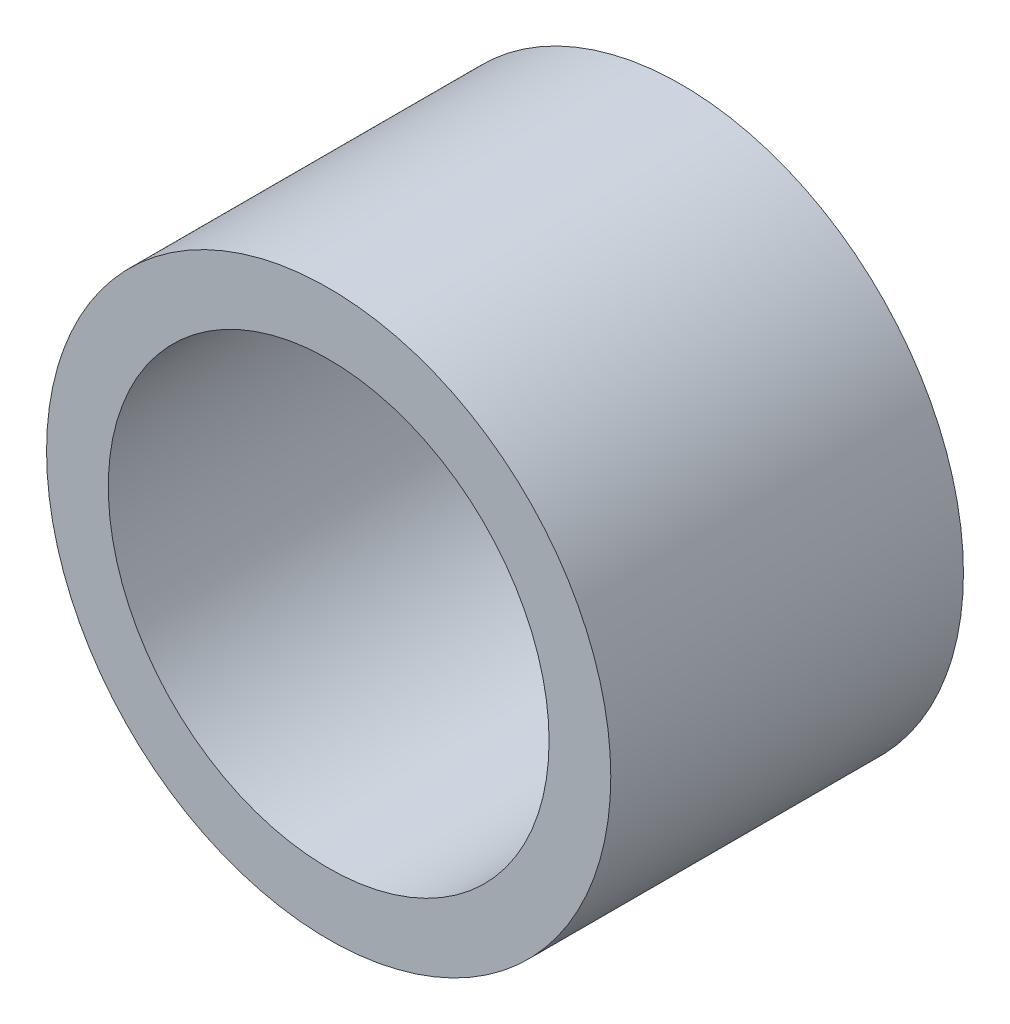
from build123d import *

# Parameters (mm, degrees)
ESBO_O1_R                = 16
RESSALTO_EXTRUS_O1_DEPTH = 20
ESBO_O2_R                = 12.5
CORTE_EXTRUS_O1_DEPTH    = 20


with BuildPart() as part:
    # Esboço1 → Ressalto-extrusão1 (new body)
    with BuildSketch(Plane.XY):
        Circle(ESBO_O1_R)
    extrude(amount=RESSALTO_EXTRUS_O1_DEPTH)

    # Esboço2 → Corte-extrusão1 (cut)
    with BuildSketch(Plane.XY.offset(20)):
        Circle(ESBO_O2_R)
    extrude(amount=-CORTE_EXTRUS_O1_DEPTH, mode=Mode.SUBTRACT)


solid = part.part
